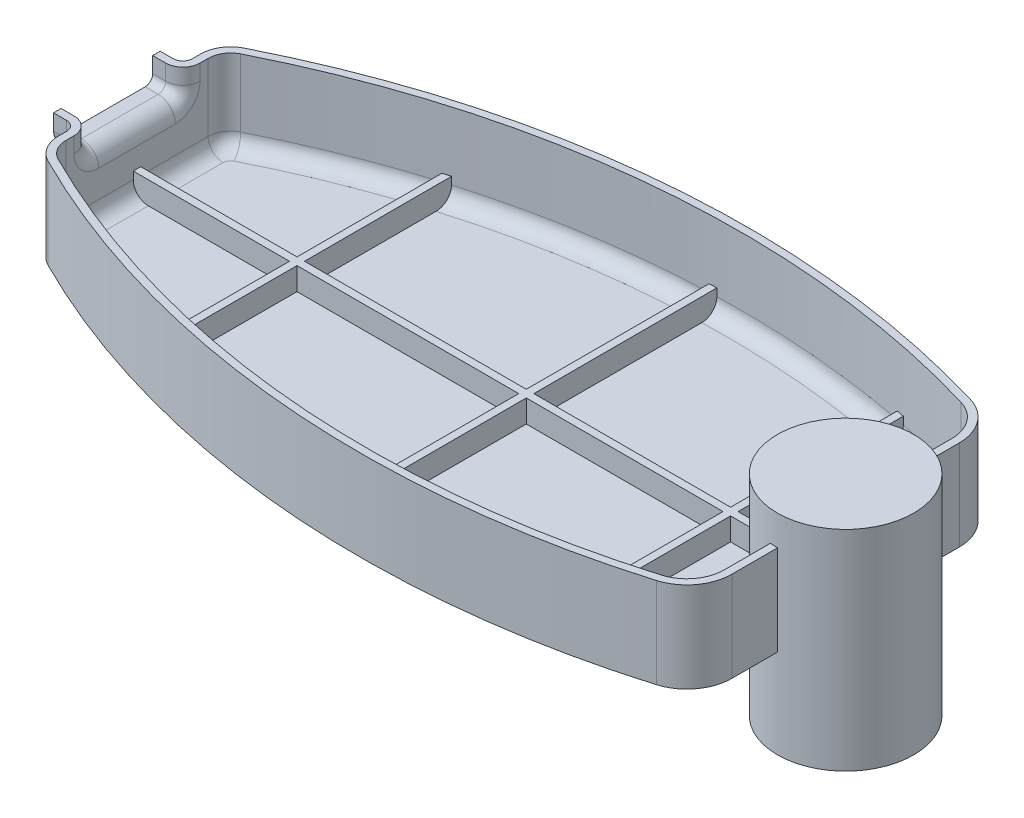
from build123d import *

# Parameters (mm, degrees)
BOSS_EXTRUDE1_DEPTH = 19.05
BOSS_EXTRUDE2_REACH = 164.365
FILLET2_R           = 2.032
SHELL1_T            = -1.5875
SKETCH6_R           = 14.38546282
BOSS_EXTRUDE3_DEPTH = 44.196
FILLET3_R           = 3.175
RIB1_REACH          = 174.398
SKETCH3_WALLS_W     = 491.592314098
SKETCH3_WALLS_H     = 1.5875
SKETCH3_WALLS_W_2   = 1.5875
SKETCH3_WALLS_H_2   = 370.365662837
SKETCH3_WALLS_H_3   = 364.731456944
SKETCH3_WALLS_H_4   = 378.244453173
SKETCH3_WALLS_H_5   = 370.112190103
SKETCH3_WALLS_H_6   = 377.142820727
SKETCH3_WALLS_H_7   = 367.242465752


with BuildPart() as part:
    # Sketch1 → Boss-Extrude1 (new body)
    with BuildSketch(Plane(origin=(0, 0, 0), x_dir=(1, 0, 0), z_dir=(0, 1, 0))):
        with BuildLine():
            Line((151.14663435, 23.998631985), (151.14663435, -23.998631985))
            ThreePointArc((151.14663435, -23.998631985), (149.255998086, -29.694430028), (144.334641628, -33.129087424))
            ThreePointArc((144.334641628, -33.129087424), (72.730464863, -40.337037619), (3.501469246, -20.678481157))
            ThreePointArc((3.501469246, -20.678481157), (0.945803932, -18.337480359), (0, -15.003239088))
            Line((0, -15.003239088), (0, 15.003239088))
            ThreePointArc((0, 15.003239088), (0.945803932, 18.337480359), (3.501469246, 20.678481157))
            ThreePointArc((3.501469246, 20.678481157), (72.730464863, 40.337037619), (144.334641628, 33.129087424))
            ThreePointArc((144.334641628, 33.129087424), (149.255998086, 29.694430028), (151.14663435, 23.998631985))
        make_face()
    extrude(amount=-BOSS_EXTRUDE1_DEPTH)

    # Sketch2 → Boss-Extrude2 (add, up to next)
    with BuildSketch(Plane.ZY.offset(4.7752), mode=Mode.PRIVATE) as boss_extrude2_sk1:
        with BuildLine():
            Line((0, 0), (11.256017669, 0))
            Line((11.256017669, 0), (11.256017669, -3.332868092))
            ThreePointArc((11.256017669, -3.332868092), (10.326081699, -5.577932122), (8.081017669, -6.507868092))
            Line((8.081017669, -6.507868092), (-8.081017669, -6.507868092))
            ThreePointArc((-8.081017669, -6.507868092), (-10.326081699, -5.577932122), (-11.256017669, -3.332868092))
            Line((-11.256017669, -3.332868092), (-11.256017669, 0))
            Line((-11.256017669, 0), (0, 0))
        make_face()
    boss_extrude2_tool1 = extrude(boss_extrude2_sk1.sketch, amount=-BOSS_EXTRUDE2_REACH, mode=Mode.PRIVATE) - part.part
    add(boss_extrude2_tool1.solids().sort_by_distance((-4.7752, -3.176495, 0))[0])

    # Fillet2
    fillet2_edges = [part.edges().sort_by_distance(p)[0] for p in [
        (0, -1.666434046, -11.256017669),
        (0, -1.666434046, 11.256017669),
        (0, -5.577932122, 10.326081699),
        (0, -6.507868092, 0),
        (0, -5.577932122, -10.326081699),
    ]]
    fillet(fillet2_edges, radius=FILLET2_R)

    # Shell1
    shell1_openings = [part.faces().sort_by_distance(p)[0] for p in [
        (-4.7752, -3.176495023, 0),
        (78.808938496, 0, 0),
    ]]
    offset(amount=SHELL1_T, openings=shell1_openings)

    # Fillet3
    fillet3_edges = [part.edges().sort_by_distance(p)[0] for p in [
        (147.98360413, -17.4625, 28.745130354),
        (72.870265354, -17.4625, 38.755705246),
        (1.5875, -17.4625, 0),
        (2.296852949, -17.4625, -17.503920041),
        (147.98360413, -17.4625, -28.745130354),
        (149.55913435, -17.4625, 0),
        (2.296852949, -17.4625, 17.503920041),
        (72.870265354, -17.4625, -38.755705246),
    ]]
    fillet(fillet3_edges, radius=FILLET3_R)

    # Sketch3 walls → Rib1 (add, up to next)
    with BuildSketch(Plane(origin=(0, -12.7, 0), x_dir=(-1, 0, 0), z_dir=(0, 1, 0)), mode=Mode.PRIVATE) as rib1_sk1:
        with Locations((-75.573317175, 0)):
            Rectangle(SKETCH3_WALLS_W, SKETCH3_WALLS_H)
    rib1_tool1 = extrude(rib1_sk1.sketch, amount=-RIB1_REACH, mode=Mode.PRIVATE) - part.part
    # Sketch3 walls → Rib1 (add, up to next)
    with BuildSketch(Plane(origin=(0, -12.7, 0), x_dir=(-1, 0, 0), z_dir=(0, 1, 0)), mode=Mode.PRIVATE) as rib1_sk2:
        with Locations((-35.354017225, 18.152192449)):
            Rectangle(SKETCH3_WALLS_W_2, SKETCH3_WALLS_H_2)
    rib1_tool2 = extrude(rib1_sk2.sketch, amount=-RIB1_REACH, mode=Mode.PRIVATE) - part.part
    # Sketch3 walls → Rib1 (add, up to next)
    with BuildSketch(Plane(origin=(0, -12.7, 0), x_dir=(-1, 0, 0), z_dir=(0, 1, 0)), mode=Mode.PRIVATE) as rib1_sk3:
        with Locations((-35.354017225, -12.644722923)):
            Rectangle(SKETCH3_WALLS_W_2, SKETCH3_WALLS_H_3)
    rib1_tool3 = extrude(rib1_sk3.sketch, amount=-RIB1_REACH, mode=Mode.PRIVATE) - part.part
    # Sketch3 walls → Rib1 (add, up to next)
    with BuildSketch(Plane(origin=(0, -12.7, 0), x_dir=(-1, 0, 0), z_dir=(0, 1, 0)), mode=Mode.PRIVATE) as rib1_sk4:
        with Locations((-83.743547004, 22.091587617)):
            Rectangle(SKETCH3_WALLS_W_2, SKETCH3_WALLS_H_4)
    rib1_tool4 = extrude(rib1_sk4.sketch, amount=-RIB1_REACH, mode=Mode.PRIVATE) - part.part
    # Sketch3 walls → Rib1 (add, up to next)
    with BuildSketch(Plane(origin=(0, -12.7, 0), x_dir=(-1, 0, 0), z_dir=(0, 1, 0)), mode=Mode.PRIVATE) as rib1_sk5:
        with Locations((-83.743547004, -15.335089502)):
            Rectangle(SKETCH3_WALLS_W_2, SKETCH3_WALLS_H_5)
    rib1_tool5 = extrude(rib1_sk5.sketch, amount=-RIB1_REACH, mode=Mode.PRIVATE) - part.part
    # Sketch3 walls → Rib1 (add, up to next)
    with BuildSketch(Plane(origin=(0, -12.7, 0), x_dir=(-1, 0, 0), z_dir=(0, 1, 0)), mode=Mode.PRIVATE) as rib1_sk6:
        with Locations((-126.863507058, 19.029762586)):
            Rectangle(SKETCH3_WALLS_W_2, SKETCH3_WALLS_H_6)
    rib1_tool6 = extrude(rib1_sk6.sketch, amount=-RIB1_REACH, mode=Mode.PRIVATE) - part.part
    # Sketch3 walls → Rib1 (add, up to next)
    with BuildSketch(Plane(origin=(0, -12.7, 0), x_dir=(-1, 0, 0), z_dir=(0, 1, 0)), mode=Mode.PRIVATE) as rib1_sk7:
        with Locations((-126.863507058, -13.900227327)):
            Rectangle(SKETCH3_WALLS_W_2, SKETCH3_WALLS_H_7)
    rib1_tool7 = extrude(rib1_sk7.sketch, amount=-RIB1_REACH, mode=Mode.PRIVATE) - part.part
    add(rib1_tool1.solids().sort_by_distance((75.573317175, -12.7, 0))[0])
    add(rib1_tool2.solids().sort_by_distance((35.354017225, -12.7, 18.152192449))[0])
    add(rib1_tool3.solids().sort_by_distance((35.354017225, -12.7, -12.644722923))[0])
    add(rib1_tool4.solids().sort_by_distance((83.743547004, -12.7, 22.091587617))[0])
    add(rib1_tool5.solids().sort_by_distance((83.743547004, -12.7, -15.335089503))[0])
    add(rib1_tool6.solids().sort_by_distance((126.863507058, -12.7, 19.029762586))[0])
    add(rib1_tool7.solids().sort_by_distance((126.863507058, -12.7, -13.900227327))[0])


with BuildPart() as body_2:
    # Sketch6 → Boss-Extrude3 (new body)
    with BuildSketch(Plane(origin=(0, 6.35, 0), x_dir=(-1, 0, 0), z_dir=(0, 1, 0))):
        with Locations(Location((-151.14663435, 0, 0), (0, 0, 90))):
            Circle(SKETCH6_R)
    extrude(amount=-BOSS_EXTRUDE3_DEPTH)


solid = Compound([part.part, body_2.part])
